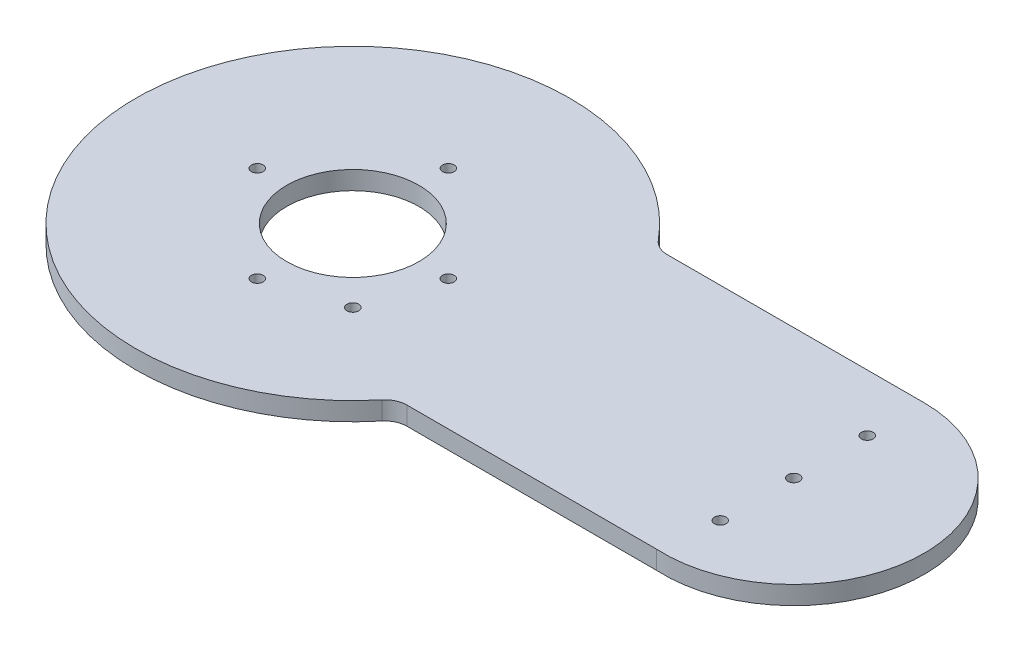
from build123d import *

# Parameters (mm, degrees)
SKETCH1_R                   = 2.0193
BOSS_EXTRUDE1_DEPTH         = 6.35
SKETCH16_R                  = 22.86
SKETCH16_R_2                = 2.0193
CUT_EXTRUDE1_DEPTH          = 6.35
FILLET1_R                   = 7.62
F_21_0_159_DIAMETER_HOLE1_D = 4.0386


with BuildPart() as part:
    # Sketch1 → Boss-Extrude1 (new body)
    with BuildSketch(Plane(origin=(0, 0, 0), x_dir=(1, 0, 0), z_dir=(0, 1, 0))):
        with BuildLine():
            Line((75, -45), (-14.998600006, -45))
            ThreePointArc((-14.998600006, -45), (-150.00112, 0), (-14.998600006, 45))
            Line((-14.998600006, 45), (77.4, 45.063954554))
            ThreePointArc((77.4, 45.063954554), (122.447963078, -1.200425985), (75, -45))
        make_face()
        with Locations(Location((77.4, 0, 0), (0, 0, 270))):
            Circle(SKETCH1_R, mode=Mode.SUBTRACT)
    extrude(amount=BOSS_EXTRUDE1_DEPTH)

    # Sketch16 → Cut-Extrude1 (cut)
    with BuildSketch(Plane(origin=(0.964771866, 6.35, 105.934324836), x_dir=(-1, 0, 0), z_dir=(0, 1, 0))):
        with Locations(Location((75.964771866, -105.934324836, 0), (0, 0, 90))):
            Circle(SKETCH16_R)
        with Locations(Location((50.800979112, -80.770532082, 0), (0, 0, 90))):
            Circle(SKETCH16_R_2)
        with Locations(Location((42.944771866, -105.934324836, 0), (0, 0, 90))):
            Circle(SKETCH16_R_2)
        with Locations(Location((75.964771866, -72.914324836, 0), (0, 0, 90))):
            Circle(SKETCH16_R_2)
        with Locations(Location((108.984771866, -105.934324836, 0), (0, 0, 90))):
            Circle(SKETCH16_R_2)
        with Locations(Location((75.964771866, -138.954324836, 0), (0, 0, 90))):
            Circle(SKETCH16_R_2)
    extrude(amount=-CUT_EXTRUDE1_DEPTH, mode=Mode.SUBTRACT)

    # Fillet1
    fillet1_edges = [part.edges().sort_by_distance(p)[0] for p in [
        (-14.998600006, 3.175, -45),
        (-14.998600006, 3.175, 45),
    ]]
    fillet(fillet1_edges, radius=FILLET1_R)

    # #21 (0.159) Diameter Hole1 (through all)
    with Locations(Plane(origin=(0, 6.35, 0), x_dir=(1, 0, 0), z_dir=(0, 1, 0))):
        with Locations((77.4, 25.4), (77.4, -25.4)):
            Hole(F_21_0_159_DIAMETER_HOLE1_D / 2)


solid = part.part
